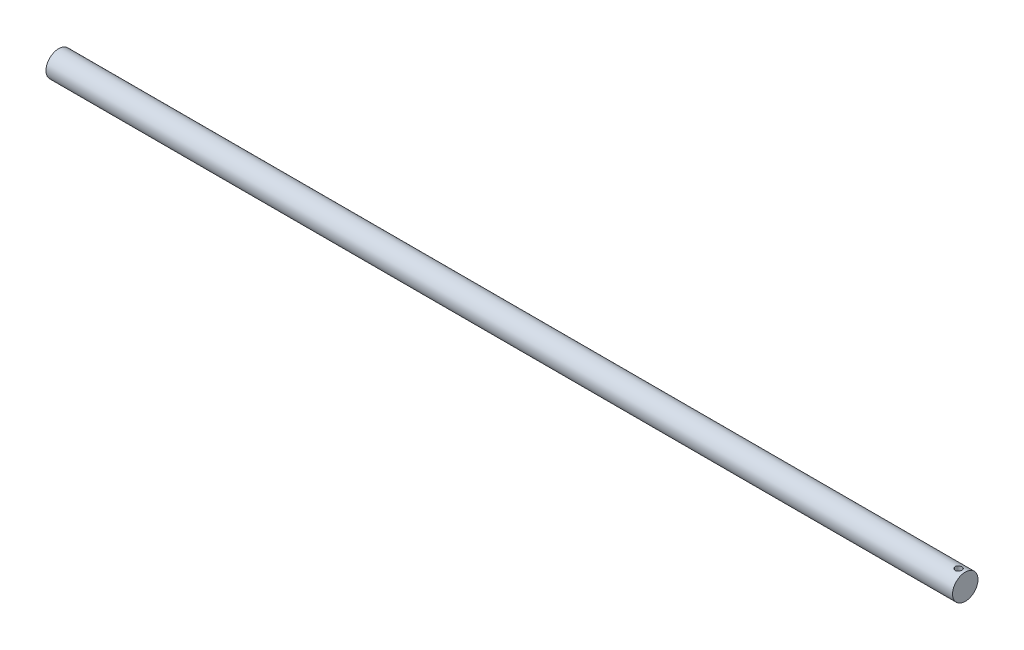
from build123d import *

# Parameters (mm, degrees)
SKETCH1_R               = 4.85
BOSS_EXTRUDE1_DEPTH     = 345.867201
CUT_EXTRUDE1_DEPTH      = 346.935204522
CUT_EXTRUDE1_DEPTH_BACK = 346.935204522
SKETCH2_R               = 1.25
SCALE1_SCALE            = 1.5


with BuildPart() as part:
    # Sketch1 → Boss-Extrude1 (new body)
    with BuildSketch(Plane(origin=(0, 0, 0), x_dir=(0, 0, -1), z_dir=(1, 0, 0))):
        Circle(SKETCH1_R)
    extrude(amount=BOSS_EXTRUDE1_DEPTH)

    # Sketch2 → Cut-Extrude1 (cut, two sides: drawn at the far end of the back side and taken through both)
    with BuildSketch(Plane(origin=(0, 0, 0), x_dir=(1, 0, 0), z_dir=(0, 1, 0)).offset(-CUT_EXTRUDE1_DEPTH_BACK)):
        with Locations(Location((343.367201, 0, 0), (0, 0, 270))):
            Circle(SKETCH2_R)
    extrude(amount=CUT_EXTRUDE1_DEPTH + CUT_EXTRUDE1_DEPTH_BACK, mode=Mode.SUBTRACT)


with BuildPart() as part_1:
    # Scale1: scaled about (172.618275836, 0, 1.121e-06)
    add(part.part.scale(SCALE1_SCALE).moved(Location((-86.309137918, 0, -5.6e-07))))


solid = part_1.part
